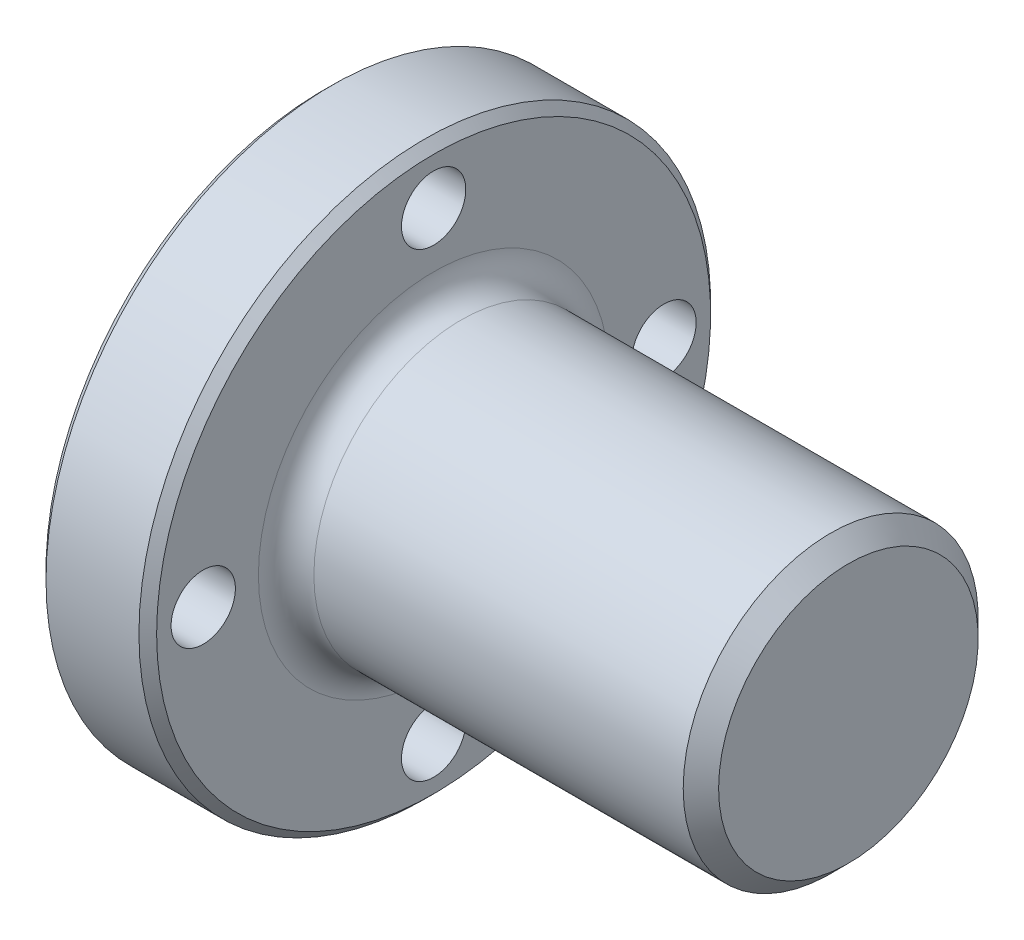
from build123d import *

# Parameters (mm, degrees)
CUT_EXTRUDE2_START = 4.826
SKETCH2_R          = 2.7686
CUT_EXTRUDE2_DEPTH = 57.148619122
CUT_EXTRUDE4_START = 4.826
SKETCH3_R          = 2.7686
CUT_EXTRUDE4_DEPTH = 57.148619122
FILLET1_R          = 2.3876
CHAMFER1_SIZE      = 0.762
CHAMFER2_SIZE      = 1.524


with BuildPart() as part:
    # Sketch1 → Revolve1 (revolve)
    with BuildSketch(Plane(origin=(0, 0, 0), x_dir=(0, 1, 0), z_dir=(0, 0, 1)), mode=Mode.PRIVATE) as revolve1_sk:
        Polygon((0, 0), (8.7122, 0), (8.7122, -4.826), (24.6126, -4.826), (24.6126, -14.351), (12.7, -14.351), (12.7, -50.0634), (0, -50.0634), align=None)
    revolve(revolve1_sk.sketch.rotate(Axis((-25.4, 0, 0), (1, 0, 0)), 90), axis=Axis((-25.4, 0, 0), (1, 0, 0)))

    # Sketch2 → Cut-Extrude2 (cut, through all)
    with BuildSketch(Plane.YZ.offset(CUT_EXTRUDE2_START)):
        with Locations(Location((19.8374, 0, 0), (0, 0, 90))):
            Circle(SKETCH2_R)
    extrude(amount=CUT_EXTRUDE2_DEPTH, mode=Mode.SUBTRACT)

    # Sketch3 → Cut-Extrude4 (cut, through all)
    with BuildSketch(Plane.YZ.offset(CUT_EXTRUDE4_START)):
        with Locations(Location((0, 19.8374, 0), (0, 0, 90))):
            Circle(SKETCH3_R)
        with Locations(Location((-19.8374, 0, 0), (0, 0, 90))):
            Circle(SKETCH3_R)
        with Locations(Location((0, -19.8374, 0), (0, 0, 90))):
            Circle(SKETCH3_R)
    extrude(amount=CUT_EXTRUDE4_DEPTH, mode=Mode.SUBTRACT)

    # Fillet1
    fillet1_edges = [part.edges().sort_by_distance(p)[0] for p in [
        (14.351, 0, -12.7),
    ]]
    fillet(fillet1_edges, radius=FILLET1_R)

    # Chamfer1
    chamfer1_edges = [part.edges().sort_by_distance(p)[0] for p in [
        (14.351, 0, -24.6126),
        (4.826, 0, -24.6126),
    ]]
    chamfer(chamfer1_edges, length=CHAMFER1_SIZE)

    # Chamfer2
    chamfer2_edges = [part.edges().sort_by_distance(p)[0] for p in [
        (50.0634, 0, -12.7),
    ]]
    chamfer(chamfer2_edges, length=CHAMFER2_SIZE)


solid = part.part
